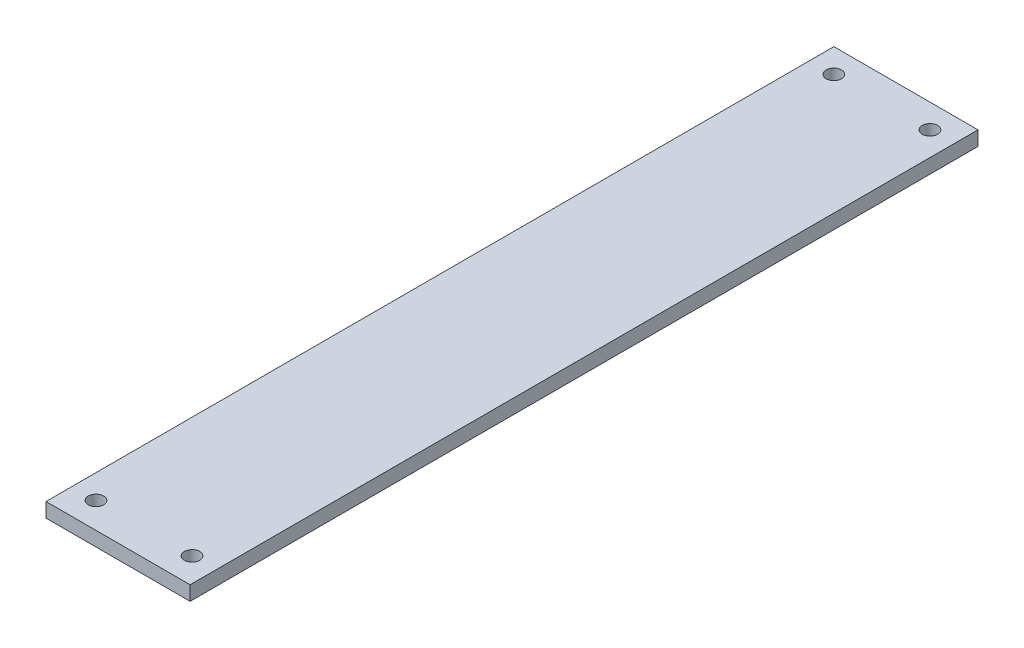
from build123d import *

# Parameters (mm, degrees)
SKETCH1_W           = 30
SKETCH1_H           = 164
BOSS_EXTRUDE1_DEPTH = 3
SKETCH2_R           = 1.6
CUT_EXTRUDE1_DEPTH  = 10


with BuildPart() as part:
    # Sketch1 → Boss-Extrude1 (new body)
    with BuildSketch(Plane(origin=(0, 0, 0), x_dir=(1, 0, 0), z_dir=(0, 1, 0))):
        with Locations((15, 82)):
            Rectangle(SKETCH1_W, SKETCH1_H)
    extrude(amount=BOSS_EXTRUDE1_DEPTH)

    # Sketch2 → Cut-Extrude1 (cut)
    with BuildSketch(Plane(origin=(0, 3, 0), x_dir=(1, 0, 0), z_dir=(0, 1, 0))):
        with Locations(Location((25, 159, 0), (0, 0, 270))):
            Circle(SKETCH2_R)
        with Locations(Location((25, 5.4, 0), (0, 0, 270))):
            Circle(SKETCH2_R)
        with Locations(Location((5, 159, 0), (0, 0, 270))):
            Circle(SKETCH2_R)
        with Locations(Location((5, 5.4, 0), (0, 0, 270))):
            Circle(SKETCH2_R)
    extrude(amount=-CUT_EXTRUDE1_DEPTH, mode=Mode.SUBTRACT)


solid = part.part
